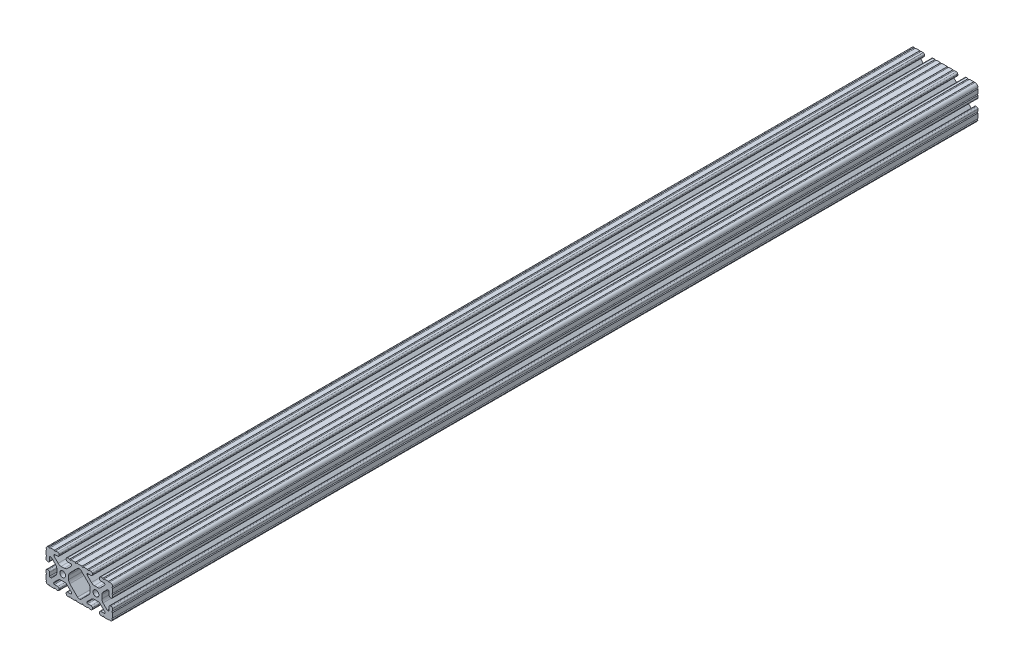
from build123d import *

# Parameters (mm, degrees)
SKETCH1_R      = 3.3274
EXTRUDE1_DEPTH = 990.6


with BuildPart() as part:
    # Sketch1 → Extrude1 (new body)
    with BuildSketch(Plane.XY):
        with BuildLine():
            Line((-3.121121376, -19.05), (3.121121376, -19.05))
            ThreePointArc((3.121121376, -19.05), (3.883121376, -18.288), (4.645121376, -19.05))
            Line((4.645121376, -19.05), (8.633115796, -19.05))
            Line((8.633115796, -19.05), (9.473536067, -19.05))
            ThreePointArc((9.473536067, -19.05), (10.235536067, -18.288), (10.997536067, -19.05))
            Line((10.997536067, -19.05), (13.4112, -19.05))
            ThreePointArc((13.4112, -19.05), (14.524751759, -18.588751759), (14.986, -17.4752))
            Line((14.986, -17.4752), (14.986, -16.5608))
            ThreePointArc((14.986, -16.5608), (14.524751759, -15.447248241), (13.4112, -14.986))
            Line((13.4112, -14.986), (9.652, -14.986))
            ThreePointArc((9.652, -14.986), (9.023382072, -14.725617928), (8.763, -14.097))
            Line((8.763, -14.097), (8.763, -13.687179678))
            ThreePointArc((8.763, -13.687179678), (8.830670671, -13.346975131), (9.023380503, -13.058563318))
            Line((9.023380503, -13.058563318), (13.852498595, -8.229421131))
            ThreePointArc((13.852498595, -8.229421131), (15.393447522, -7.199787805), (17.211122763, -6.838228541))
            Line((17.211122763, -6.838228541), (20.888877237, -6.838228541))
            ThreePointArc((20.888877237, -6.838228541), (22.706552478, -7.199787805), (24.247501405, -8.229421131))
            Line((24.247501405, -8.229421131), (29.076619497, -13.058563318))
            ThreePointArc((29.076619497, -13.058563318), (29.269329329, -13.346975131), (29.337, -13.687179678))
            Line((29.337, -13.687179678), (29.337, -14.097))
            ThreePointArc((29.337, -14.097), (29.076617928, -14.725617928), (28.448, -14.986))
            Line((28.448, -14.986), (24.6888, -14.986))
            ThreePointArc((24.6888, -14.986), (23.575248241, -15.447248241), (23.114, -16.5608))
            Line((23.114, -16.5608), (23.114, -17.4752))
            ThreePointArc((23.114, -17.4752), (23.575248241, -18.588751759), (24.6888, -19.05))
            Line((24.6888, -19.05), (26.945817469, -19.05))
            ThreePointArc((26.945817469, -19.05), (27.707817469, -18.288), (28.469817469, -19.05))
            Line((28.469817469, -19.05), (29.207115796, -19.05))
            Line((29.207115796, -19.05), (34.047273398, -19.05))
            ThreePointArc((34.047273398, -19.05), (34.809273398, -18.288), (35.571273398, -19.05))
            ThreePointArc((35.571273398, -19.05), (37.207577603, -18.182738167), (38.1, -16.560019212))
            ThreePointArc((38.1, -16.560019212), (37.338, -15.798019212), (38.1, -15.036019212))
            Line((38.1, -15.036019212), (38.1, -10.287))
            Line((38.1, -10.287), (38.1, -9.549701672))
            ThreePointArc((38.1, -9.549701672), (37.338, -8.787701672), (38.1, -8.025701672))
            Line((38.1, -8.025701672), (38.1, -5.6388))
            ThreePointArc((38.1, -5.6388), (37.638751759, -4.525248241), (36.5252, -4.064))
            Line((36.5252, -4.064), (35.6108, -4.064))
            ThreePointArc((35.6108, -4.064), (34.497248241, -4.525248241), (34.036, -5.6388))
            Line((34.036, -5.6388), (34.036, -9.398))
            ThreePointArc((34.036, -9.398), (33.775617928, -10.026617928), (33.147, -10.287))
            Line((33.147, -10.287), (32.420656743, -10.287))
            ThreePointArc((32.420656743, -10.287), (32.080450147, -10.21932848), (31.792037247, -10.02661636))
            Line((31.792037247, -10.02661636), (27.197575832, -5.43213202))
            ThreePointArc((27.197575832, -5.43213202), (26.167954729, -3.891188903), (25.8064, -2.07352461))
            Line((25.8064, -2.07352461), (25.8064, 2.07352461))
            ThreePointArc((25.8064, 2.07352461), (26.167954729, 3.891188903), (27.197575832, 5.43213202))
            Line((27.197575832, 5.43213202), (31.792037247, 10.02661636))
            ThreePointArc((31.792037247, 10.02661636), (32.080450147, 10.21932848), (32.420656743, 10.287))
            Line((32.420656743, 10.287), (33.147, 10.287))
            ThreePointArc((33.147, 10.287), (33.775617928, 10.026617928), (34.036, 9.398))
            Line((34.036, 9.398), (34.036, 5.6388))
            ThreePointArc((34.036, 5.6388), (34.497248241, 4.525248241), (35.6108, 4.064))
            Line((35.6108, 4.064), (36.5252, 4.064))
            ThreePointArc((36.5252, 4.064), (37.638751759, 4.525248241), (38.1, 5.6388))
            Line((38.1, 5.6388), (38.1, 8.025701672))
            ThreePointArc((38.1, 8.025701672), (37.338, 8.787701672), (38.1, 9.549701672))
            Line((38.1, 9.549701672), (38.1, 10.287))
            Line((38.1, 10.287), (38.1, 14.375206214))
            ThreePointArc((38.1, 14.375206214), (37.338232276, 15.156019383), (38.137614868, 15.89827725))
            ThreePointArc((38.137614868, 15.89827725), (37.148019028, 18.192014021), (34.819536496, 19.096833012))
            ThreePointArc((34.819536496, 19.096833012), (34.081312886, 18.311776389), (33.296256263, 19.05))
            Line((33.296256263, 19.05), (29.207115796, 19.05))
            Line((29.207115796, 19.05), (28.469817468, 19.05))
            ThreePointArc((28.469817468, 19.05), (27.707817468, 18.288), (26.945817468, 19.05))
            Line((26.945817468, 19.05), (24.558915796, 19.05))
            ThreePointArc((24.558915796, 19.05), (23.53023695, 18.547208069), (23.114, 17.480565346))
            Line((23.114, 17.480565346), (23.114, 16.5608))
            ThreePointArc((23.114, 16.5608), (23.575248241, 15.447248241), (24.6888, 14.986))
            Line((24.6888, 14.986), (28.295243665, 14.986))
            ThreePointArc((28.295243665, 14.986), (28.923861593, 14.725617928), (29.184243665, 14.097))
            Line((29.184243665, 14.097), (29.184243665, 13.53442258))
            ThreePointArc((29.184243665, 13.53442258), (29.116572993, 13.194218033), (28.923863161, 12.90580622))
            Line((28.923863161, 12.90580622), (24.247501405, 8.229421131))
            ThreePointArc((24.247501405, 8.229421131), (22.706552478, 7.199787805), (20.888877237, 6.838228541))
            Line((20.888877237, 6.838228541), (17.211122763, 6.838228541))
            ThreePointArc((17.211122763, 6.838228541), (15.393447522, 7.199787805), (13.852498595, 8.229421131))
            Line((13.852498595, 8.229421131), (9.176136839, 12.90580622))
            ThreePointArc((9.176136839, 12.90580622), (8.983427007, 13.194218033), (8.915756335, 13.53442258))
            Line((8.915756335, 13.53442258), (8.915756335, 14.097))
            ThreePointArc((8.915756335, 14.097), (9.176138407, 14.725617928), (9.804756335, 14.986))
            Line((9.804756335, 14.986), (13.4112, 14.986))
            ThreePointArc((13.4112, 14.986), (14.524751759, 15.447248241), (14.986, 16.5608))
            Line((14.986, 16.5608), (14.986, 17.496772581))
            ThreePointArc((14.986, 17.496772581), (14.531070222, 18.595070222), (13.432772581, 19.05))
            Line((13.432772581, 19.05), (10.997536067, 19.05))
            ThreePointArc((10.997536067, 19.05), (10.235536067, 18.288), (9.473536067, 19.05))
            Line((9.473536067, 19.05), (8.633115796, 19.05))
            Line((8.633115796, 19.05), (4.645121376, 19.05))
            ThreePointArc((4.645121376, 19.05), (3.883121376, 18.288), (3.121121376, 19.05))
            Line((3.121121376, 19.05), (-3.121121376, 19.05))
            ThreePointArc((-3.121121376, 19.05), (-3.883121376, 18.288), (-4.645121376, 19.05))
            Line((-4.645121376, 19.05), (-8.633115796, 19.05))
            Line((-8.633115796, 19.05), (-9.473536067, 19.05))
            ThreePointArc((-9.473536067, 19.05), (-10.235536067, 18.288), (-10.997536067, 19.05))
            Line((-10.997536067, 19.05), (-13.432772581, 19.05))
            ThreePointArc((-13.432772581, 19.05), (-14.531070222, 18.595070222), (-14.986, 17.496772581))
            Line((-14.986, 17.496772581), (-14.986, 16.5608))
            ThreePointArc((-14.986, 16.5608), (-14.524751759, 15.447248241), (-13.4112, 14.986))
            Line((-13.4112, 14.986), (-9.804756335, 14.986))
            ThreePointArc((-9.804756335, 14.986), (-9.176138407, 14.725617928), (-8.915756335, 14.097))
            Line((-8.915756335, 14.097), (-8.915756335, 13.53442258))
            ThreePointArc((-8.915756335, 13.53442258), (-8.983427007, 13.194218033), (-9.176136839, 12.90580622))
            Line((-9.176136839, 12.90580622), (-13.852498595, 8.229421131))
            ThreePointArc((-13.852498595, 8.229421131), (-15.393447522, 7.199787805), (-17.211122763, 6.838228541))
            Line((-17.211122763, 6.838228541), (-20.888877237, 6.838228541))
            ThreePointArc((-20.888877237, 6.838228541), (-22.706552478, 7.199787805), (-24.247501405, 8.229421131))
            Line((-24.247501405, 8.229421131), (-28.923863161, 12.90580622))
            ThreePointArc((-28.923863161, 12.90580622), (-29.116572993, 13.194218033), (-29.184243665, 13.53442258))
            Line((-29.184243665, 13.53442258), (-29.184243665, 14.097))
            ThreePointArc((-29.184243665, 14.097), (-28.923861593, 14.725617928), (-28.295243665, 14.986))
            Line((-28.295243665, 14.986), (-24.6888, 14.986))
            ThreePointArc((-24.6888, 14.986), (-23.575248241, 15.447248241), (-23.114, 16.5608))
            Line((-23.114, 16.5608), (-23.114, 17.480565346))
            ThreePointArc((-23.114, 17.480565346), (-23.53023695, 18.547208069), (-24.558915796, 19.05))
            Line((-24.558915796, 19.05), (-26.945817468, 19.05))
            ThreePointArc((-26.945817468, 19.05), (-27.707817468, 18.288), (-28.469817468, 19.05))
            Line((-28.469817468, 19.05), (-29.207115796, 19.05))
            Line((-29.207115796, 19.05), (-33.296256263, 19.05))
            ThreePointArc((-33.296256263, 19.05), (-34.081312886, 18.311776389), (-34.819536496, 19.096833012))
            ThreePointArc((-34.819536496, 19.096833012), (-37.148019028, 18.192014021), (-38.137614868, 15.89827725))
            ThreePointArc((-38.137614868, 15.89827725), (-37.338232276, 15.156019383), (-38.1, 14.375206214))
            Line((-38.1, 14.375206214), (-38.1, 10.287))
            Line((-38.1, 10.287), (-38.1, 9.549701672))
            ThreePointArc((-38.1, 9.549701672), (-37.338, 8.787701672), (-38.1, 8.025701672))
            Line((-38.1, 8.025701672), (-38.1, 5.6388))
            ThreePointArc((-38.1, 5.6388), (-37.638751759, 4.525248241), (-36.5252, 4.064))
            Line((-36.5252, 4.064), (-35.6108, 4.064))
            ThreePointArc((-35.6108, 4.064), (-34.497248241, 4.525248241), (-34.036, 5.6388))
            Line((-34.036, 5.6388), (-34.036, 9.398))
            ThreePointArc((-34.036, 9.398), (-33.775617928, 10.026617928), (-33.147, 10.287))
            Line((-33.147, 10.287), (-32.420656743, 10.287))
            ThreePointArc((-32.420656743, 10.287), (-32.080450147, 10.21932848), (-31.792037247, 10.02661636))
            Line((-31.792037247, 10.02661636), (-27.197575832, 5.43213202))
            ThreePointArc((-27.197575832, 5.43213202), (-26.167954729, 3.891188903), (-25.8064, 2.07352461))
            Line((-25.8064, 2.07352461), (-25.8064, -2.07352461))
            ThreePointArc((-25.8064, -2.07352461), (-26.167954729, -3.891188903), (-27.197575832, -5.43213202))
            Line((-27.197575832, -5.43213202), (-31.792037247, -10.02661636))
            ThreePointArc((-31.792037247, -10.02661636), (-32.080450147, -10.21932848), (-32.420656743, -10.287))
            Line((-32.420656743, -10.287), (-33.147, -10.287))
            ThreePointArc((-33.147, -10.287), (-33.775617928, -10.026617928), (-34.036, -9.398))
            Line((-34.036, -9.398), (-34.036, -5.6388))
            ThreePointArc((-34.036, -5.6388), (-34.497248241, -4.525248241), (-35.6108, -4.064))
            Line((-35.6108, -4.064), (-36.5252, -4.064))
            ThreePointArc((-36.5252, -4.064), (-37.638751759, -4.525248241), (-38.1, -5.6388))
            Line((-38.1, -5.6388), (-38.1, -8.025701672))
            ThreePointArc((-38.1, -8.025701672), (-37.338, -8.787701672), (-38.1, -9.549701672))
            Line((-38.1, -9.549701672), (-38.1, -10.287))
            Line((-38.1, -10.287), (-38.1, -15.036019212))
            ThreePointArc((-38.1, -15.036019212), (-37.338, -15.798019212), (-38.1, -16.560019212))
            ThreePointArc((-38.1, -16.560019212), (-37.20882252, -18.184002456), (-35.571273398, -19.05))
            ThreePointArc((-35.571273398, -19.05), (-34.809273398, -18.288), (-34.047273398, -19.05))
            Line((-34.047273398, -19.05), (-29.207115796, -19.05))
            Line((-29.207115796, -19.05), (-28.469817469, -19.05))
            ThreePointArc((-28.469817469, -19.05), (-27.707817469, -18.288), (-26.945817469, -19.05))
            Line((-26.945817469, -19.05), (-24.6888, -19.05))
            ThreePointArc((-24.6888, -19.05), (-23.575248241, -18.588751759), (-23.114, -17.4752))
            Line((-23.114, -17.4752), (-23.114, -16.5608))
            ThreePointArc((-23.114, -16.5608), (-23.575248241, -15.447248241), (-24.6888, -14.986))
            Line((-24.6888, -14.986), (-28.448, -14.986))
            ThreePointArc((-28.448, -14.986), (-29.076617928, -14.725617928), (-29.337, -14.097))
            Line((-29.337, -14.097), (-29.337, -13.687179678))
            ThreePointArc((-29.337, -13.687179678), (-29.269329329, -13.346975131), (-29.076619497, -13.058563318))
            Line((-29.076619497, -13.058563318), (-24.247501405, -8.229421131))
            ThreePointArc((-24.247501405, -8.229421131), (-22.706552478, -7.199787805), (-20.888877237, -6.838228541))
            Line((-20.888877237, -6.838228541), (-17.211122763, -6.838228541))
            ThreePointArc((-17.211122763, -6.838228541), (-15.393447522, -7.199787805), (-13.852498595, -8.229421131))
            Line((-13.852498595, -8.229421131), (-9.023380503, -13.058563318))
            ThreePointArc((-9.023380503, -13.058563318), (-8.830670671, -13.346975131), (-8.763, -13.687179678))
            Line((-8.763, -13.687179678), (-8.763, -14.097))
            ThreePointArc((-8.763, -14.097), (-9.023382072, -14.725617928), (-9.652, -14.986))
            Line((-9.652, -14.986), (-13.4112, -14.986))
            ThreePointArc((-13.4112, -14.986), (-14.524751759, -15.447248241), (-14.986, -16.5608))
            Line((-14.986, -16.5608), (-14.986, -17.4752))
            ThreePointArc((-14.986, -17.4752), (-14.524751759, -18.588751759), (-13.4112, -19.05))
            Line((-13.4112, -19.05), (-10.997536067, -19.05))
            ThreePointArc((-10.997536067, -19.05), (-10.235536067, -18.288), (-9.473536067, -19.05))
            Line((-9.473536067, -19.05), (-8.633115796, -19.05))
            Line((-8.633115796, -19.05), (-4.645121376, -19.05))
            ThreePointArc((-4.645121376, -19.05), (-3.883121376, -18.288), (-3.121121376, -19.05))
        make_face()
        with Locations((19.05, 0)):
            Circle(SKETCH1_R, mode=Mode.SUBTRACT)
        with Locations(Location((-19.05, 0, 0), (0, 0, 180))):
            Circle(SKETCH1_R, mode=Mode.SUBTRACT)
        with BuildLine():
            Line((2.077035361, 14.257564863), (10.902424168, 5.43213202))
            ThreePointArc((10.902424168, 5.43213202), (11.932045271, 3.891188903), (12.2936, 2.07352461))
            Line((12.2936, 2.07352461), (12.2936, -2.07352461))
            ThreePointArc((12.2936, -2.07352461), (11.932045271, -3.891188903), (10.902424168, -5.43213202))
            Line((10.902424168, -5.43213202), (2.077035361, -14.257564863))
            ThreePointArc((2.077035361, -14.257564863), (1.124045601, -14.892973012), (0, -15.113096807))
            ThreePointArc((0, -15.113096807), (-1.124045601, -14.892973012), (-2.077035361, -14.257564863))
            Line((-2.077035361, -14.257564863), (-10.902424168, -5.43213202))
            ThreePointArc((-10.902424168, -5.43213202), (-11.932045271, -3.891188903), (-12.2936, -2.07352461))
            Line((-12.2936, -2.07352461), (-12.2936, 2.07352461))
            ThreePointArc((-12.2936, 2.07352461), (-11.932045271, 3.891188903), (-10.902424168, 5.43213202))
            Line((-10.902424168, 5.43213202), (-2.077035361, 14.257564863))
            ThreePointArc((-2.077035361, 14.257564863), (-1.124045601, 14.892973012), (0, 15.113096807))
            ThreePointArc((0, 15.113096807), (1.124045601, 14.892973012), (2.077035361, 14.257564863))
        make_face(mode=Mode.SUBTRACT)
    extrude(amount=-EXTRUDE1_DEPTH)


solid = part.part
